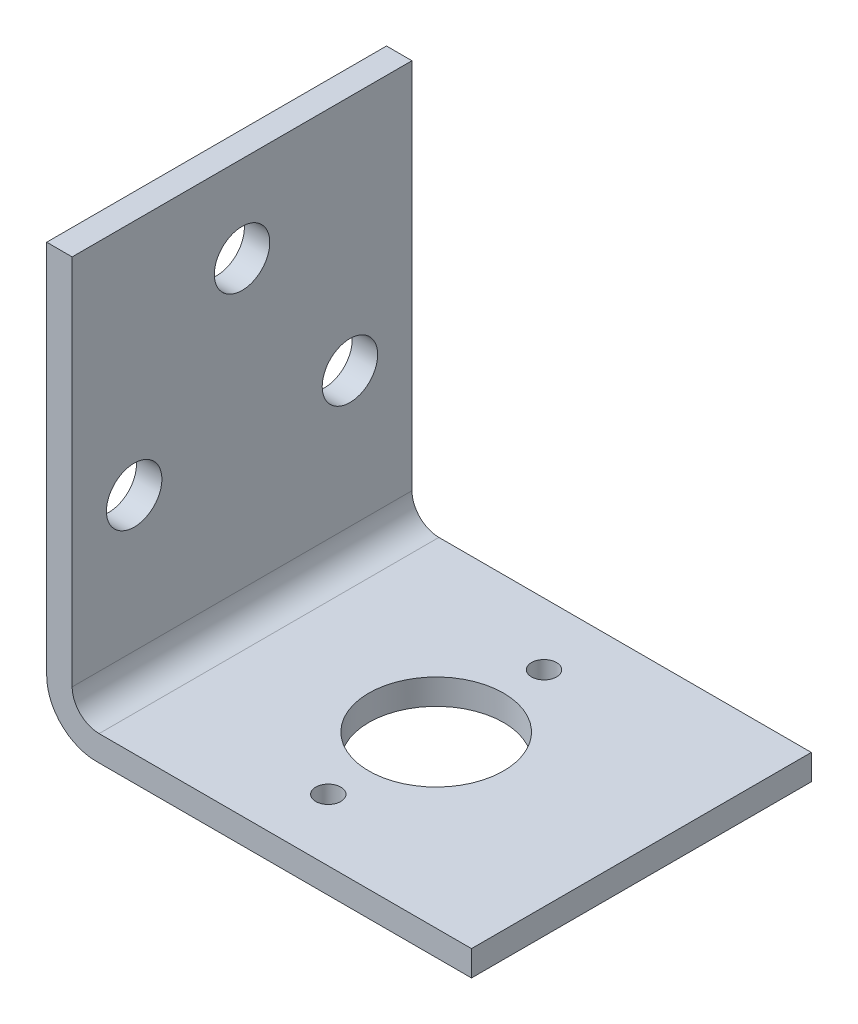
from build123d import *

# Parameters (mm, degrees)
BOSS_EXTRUDE1_DEPTH                  = 40.005
F_4_40_FOR_NUT_HORIZONTAL_DEPTH      = 82.258355524
F_4_40_FOR_NUT_HORIZONTAL_DEPTH_BACK = 82.258355524
SKETCH3_R                            = 1.4732
SKETCH3_R_2                          = 7.9375
SKETCH4_R                            = 3.2639
F_1_4_20_MOUNTING_DEPTH              = 82.258355524


with BuildPart() as part:
    # Sketch2 → Boss-Extrude1 (new body)
    with BuildSketch(Plane.XY):
        with BuildLine():
            Line((0, 5.842), (0, 50.0126))
            Line((0, 50.0126), (2.9972, 50.0126))
            Line((2.9972, 50.0126), (2.9972, 6.1722))
            ThreePointArc((2.9972, 6.1722), (3.92713597, 3.92713597), (6.1722, 2.9972))
            Line((6.1722, 2.9972), (50.0126, 2.9972))
            Line((50.0126, 2.9972), (50.0126, 0))
            Line((50.0126, 0), (5.842, 0))
            ThreePointArc((5.842, 0), (1.711082184, 1.711082184), (0, 5.842))
        make_face()
    extrude(amount=BOSS_EXTRUDE1_DEPTH)

    # Sketch3 → 4-40 For Nut Horizontal (cut, two sides: drawn at the far end of the back side and taken through both)
    with BuildSketch(Plane.XZ.offset(-F_4_40_FOR_NUT_HORIZONTAL_DEPTH_BACK)):
        with Locations(Location((25.85, 32.7025, 0), (0, 0, 270))):
            Circle(SKETCH3_R)
        with Locations(Location((25.85, 7.3025, 0), (0, 0, 270))):
            Circle(SKETCH3_R)
        with Locations(Location((25.85, 20.0025, 0), (0, 0, 270))):
            Circle(SKETCH3_R_2)
    extrude(amount=F_4_40_FOR_NUT_HORIZONTAL_DEPTH + F_4_40_FOR_NUT_HORIZONTAL_DEPTH_BACK, mode=Mode.SUBTRACT)

    # Sketch4 → 1/4-20 Mounting (cut, through all)
    with BuildSketch(Plane.ZY):
        with Locations((7.3025, 22.0726)):
            Circle(SKETCH4_R)
        with Locations((32.7025, 22.0726)):
            Circle(SKETCH4_R)
        with Locations((20.0025, 39.8526)):
            Circle(SKETCH4_R)
    extrude(amount=-F_1_4_20_MOUNTING_DEPTH, mode=Mode.SUBTRACT)


solid = part.part
